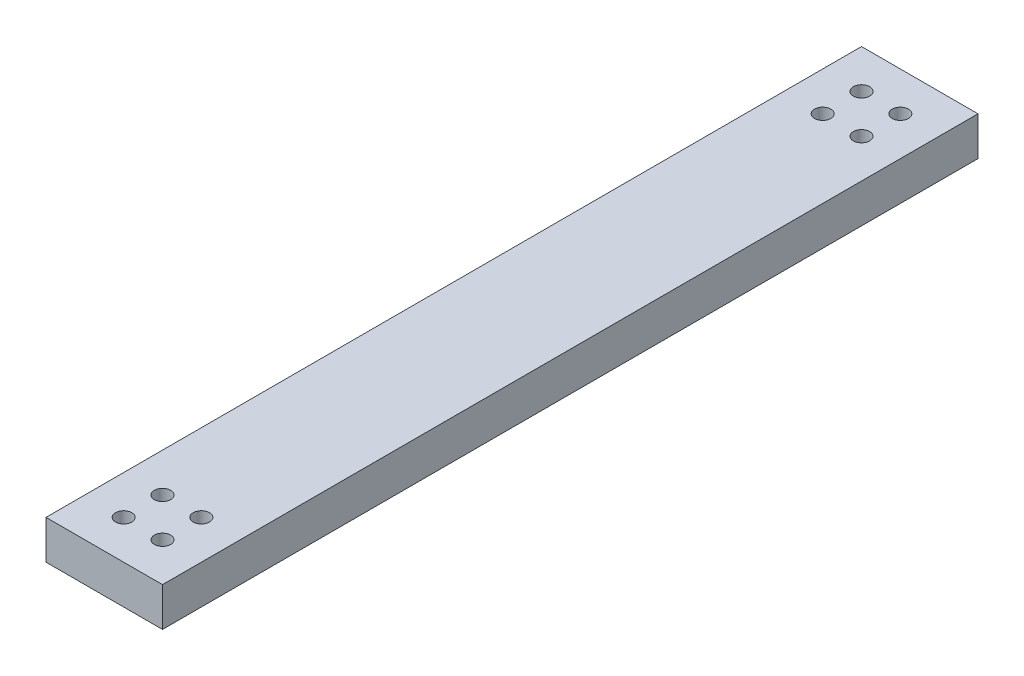
from build123d import *

# Parameters (mm, degrees)
SKETCH_1_W      = 30
SKETCH_1_H      = 210
SKETCH_1_R      = 2.1
EXTRUDE_2_DEPTH = 10


with BuildPart() as part:
    # Эскиз1 → Бобышка-Вытянуть2 (new body)
    with BuildSketch(Plane(origin=(0, 0, 0), x_dir=(1, 0, 0), z_dir=(0, 1, 0))):
        with Locations((0, -90)):
            Rectangle(SKETCH_1_W, SKETCH_1_H)
        with Locations(Location((-5, 5, 0), (0, 0, 270))):
            Circle(SKETCH_1_R, mode=Mode.SUBTRACT)
        with Locations(Location((5, 5, 0), (0, 0, 270))):
            Circle(SKETCH_1_R, mode=Mode.SUBTRACT)
        with Locations(Location((-5, -5, 0), (0, 0, 270))):
            Circle(SKETCH_1_R, mode=Mode.SUBTRACT)
        with Locations(Location((5, -5, 0), (0, 0, 270))):
            Circle(SKETCH_1_R, mode=Mode.SUBTRACT)
        with Locations(Location((-5, -175, 0), (0, 0, 270))):
            Circle(SKETCH_1_R, mode=Mode.SUBTRACT)
        with Locations(Location((5, -175, 0), (0, 0, 270))):
            Circle(SKETCH_1_R, mode=Mode.SUBTRACT)
        with Locations(Location((5, -185, 0), (0, 0, 270))):
            Circle(SKETCH_1_R, mode=Mode.SUBTRACT)
        with Locations(Location((-5, -185, 0), (0, 0, 270))):
            Circle(SKETCH_1_R, mode=Mode.SUBTRACT)
    extrude(amount=EXTRUDE_2_DEPTH)


solid = part.part
